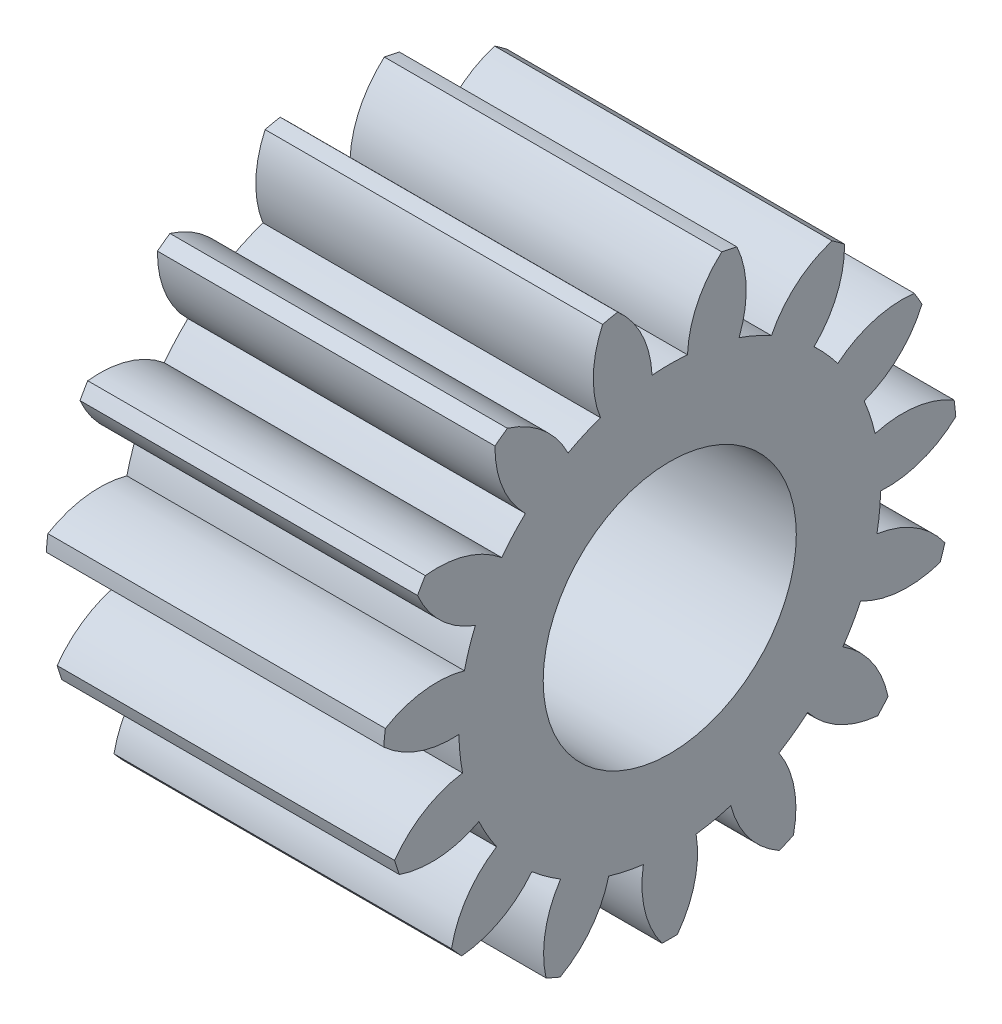
from build123d import *

# Parameters (mm, degrees)
BASPROSKE_W     = 20
BASPROSKE_H     = 17
TOOTHCUT_DEPTH  = 32.272991542
TEETHCUTS_COUNT = 15
TEETHCUTS_ANGLE = 336
BORSKE_R        = 7.5
BORE_DEPTH      = 50.0000508


with BuildPart() as part:
    # BasProSke → Base-Revolve (revolve)
    with BuildSketch(Plane(origin=(0, 0, 0), x_dir=(1, 0, 0), z_dir=(0, 1, 0)), mode=Mode.PRIVATE) as base_revolve_sk:
        with Locations((10, 8.5)):
            Rectangle(BASPROSKE_W, BASPROSKE_H)
    revolve(base_revolve_sk.sketch.rotate(Axis((-10, 0, 0), (1, 0, 0)), 180), axis=Axis((-10, 0, 0), (1, 0, 0)))

    # TooCutSke → ToothCut (cut, through all)
    with BuildSketch(Plane(origin=(0, 0, 0), x_dir=(0, 0, -1), z_dir=(1, 0, 0))):
        with BuildLine():
            ThreePointArc((1.050056448, 12.454813626), (0, 12.499), (-1.050056448, 12.454813626))
            ThreePointArc((-1.050056448, 12.454813626), (-1.638118106, 14.809604533), (-3.110934279, 16.73876737))
            ThreePointArc((-3.110934279, 16.73876737), (0, 17.0254), (3.110934279, 16.73876737))
            ThreePointArc((3.110934279, 16.73876737), (1.638118106, 14.809604533), (1.050056448, 12.454813626))
        make_face()
    toothcut = extrude(amount=TOOTHCUT_DEPTH, mode=Mode.SUBTRACT)

    # TeethCuts: ToothCut ×15 about axis
    teethcuts_axis = Axis((-10, 0, 0), (1, 0, 0))
    for i in range(1, TEETHCUTS_COUNT):
        add(toothcut.rotate(teethcuts_axis, i * TEETHCUTS_ANGLE / (TEETHCUTS_COUNT - 1)), mode=Mode.SUBTRACT)

    # BorSke → Bore (cut, symmetric)
    with BuildSketch(Plane(origin=(0, 0, 0), x_dir=(0, 0, -1), z_dir=(1, 0, 0))):
        with Locations(Location((0, 0, 0), (0, 0, 180))):
            Circle(BORSKE_R)
    extrude(amount=BORE_DEPTH, both=True, mode=Mode.SUBTRACT)


solid = part.part
